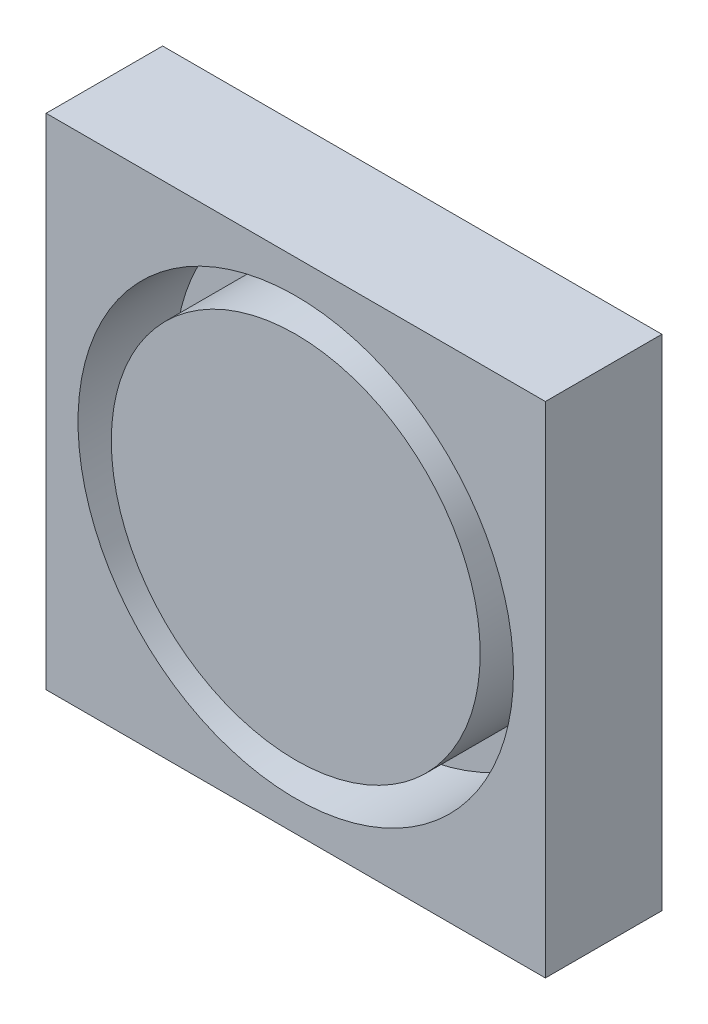
from build123d import *

# Parameters (mm, degrees)
SKETCH_1_W          = 30
SKETCH_1_H          = 30
EXTRUDE_1_DEPTH     = 7
SKETCH_5_R          = 13.083
SKETCH_5_R_2        = 11.083
CUT_EXTRUDE_1_DEPTH = 5.8


with BuildPart() as part:
    # 草图1 → 凸台-拉伸1 (new body)
    with BuildSketch(Plane.XY):
        with Locations((15, -15)):
            Rectangle(SKETCH_1_W, SKETCH_1_H)
    extrude(amount=EXTRUDE_1_DEPTH)

    # 草图5 → 切除-拉伸1 (cut)
    with BuildSketch(Plane.XY.offset(7)):
        with Locations((15, -15.083)):
            Circle(SKETCH_5_R)
        with Locations((15, -15.083)):
            Circle(SKETCH_5_R_2, mode=Mode.SUBTRACT)
    extrude(amount=-CUT_EXTRUDE_1_DEPTH, mode=Mode.SUBTRACT)


solid = part.part
